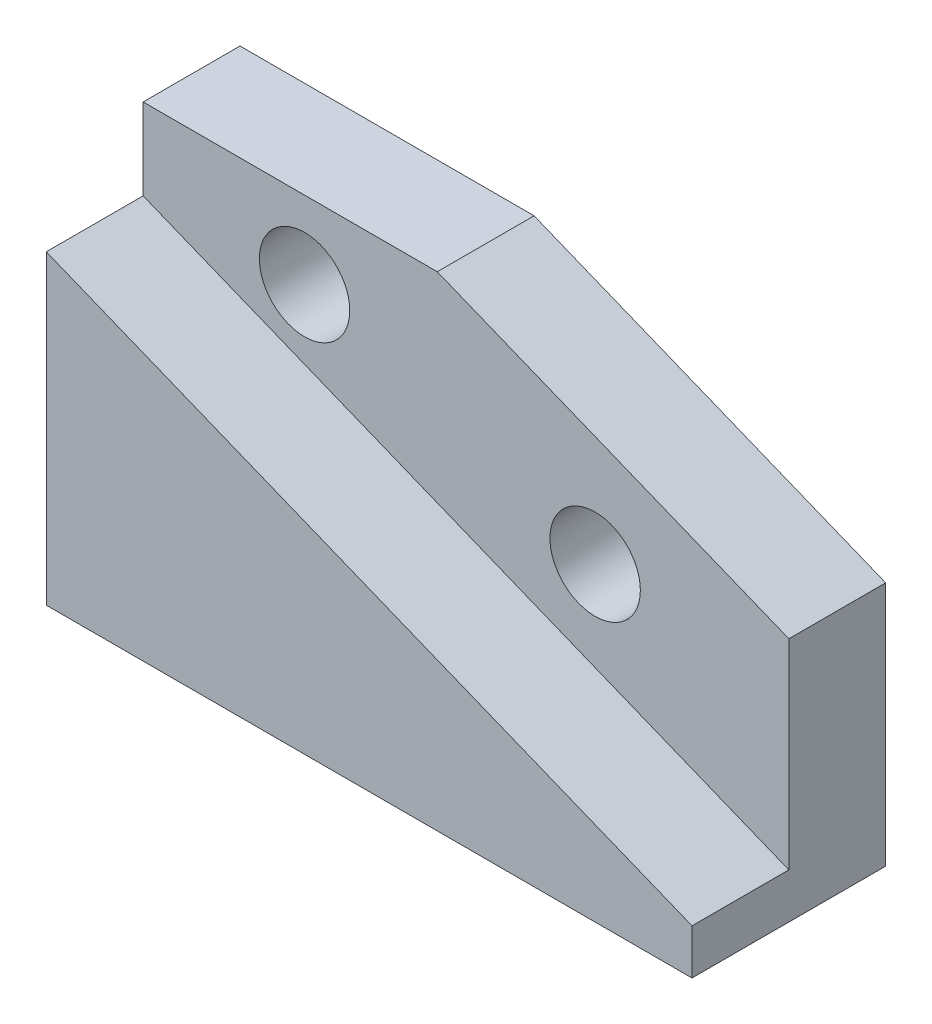
from build123d import *

# Parameters (mm, degrees)
BOSS_EXTRUDE1_DEPTH = 30
SKETCH1_3_R         = 7
BOSS_EXTRUDE2_DEPTH = 15


with BuildPart() as part:
    # Sketch1 → Boss-Extrude1 (new body)
    with BuildSketch(Plane.XY):
        Polygon((0, 47.402622584), (0, 0), (100, 0), (100, 7), align=None)
    extrude(amount=BOSS_EXTRUDE1_DEPTH)

    # Sketch1<3> → Boss-Extrude2 (add)
    with BuildSketch(Plane.XY):
        Polygon((0, 60), (0, 47.402622584), (100, 7), (100, 38), (45.548089225, 60), align=None)
        with Locations((25, 48)):
            Circle(SKETCH1_3_R, mode=Mode.SUBTRACT)
        with Locations((70, 33)):
            Circle(SKETCH1_3_R, mode=Mode.SUBTRACT)
    extrude(amount=BOSS_EXTRUDE2_DEPTH)


solid = part.part
